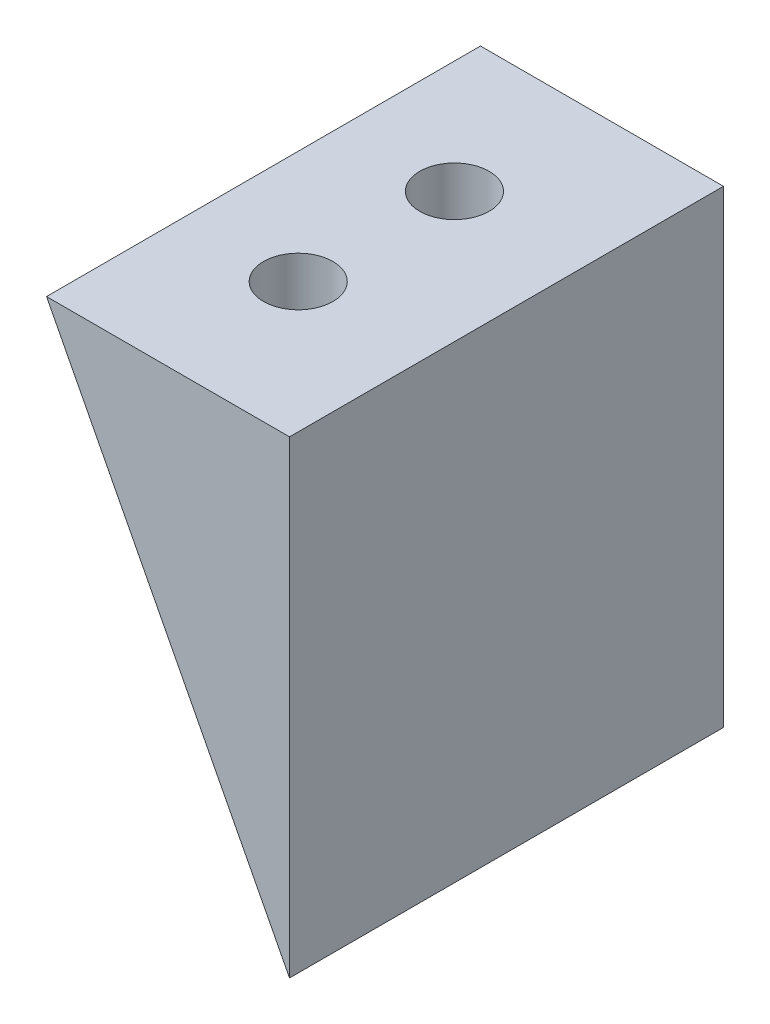
from build123d import *

# Parameters (mm, degrees)
BOSS_EXTRUDE1_DEPTH = 25
SKETCH2_R           = 2
CUT_EXTRUDE1_DEPTH  = 5


with BuildPart() as part:
    # Sketch1 → Boss-Extrude1 (new body)
    with BuildSketch(Plane.XY):
        Polygon((0, 0), (-14, 27), (0, 27), align=None)
    extrude(amount=BOSS_EXTRUDE1_DEPTH)

    # Sketch2 → Cut-Extrude1 (cut)
    with BuildSketch(Plane(origin=(0, 27, 0), x_dir=(1, 0, 0), z_dir=(0, 1, 0))):
        with Locations(Location((-7.5, -8, 0), (0, 0, 270))):
            Circle(SKETCH2_R)
        with Locations(Location((-7.5, -17, 0), (0, 0, 270))):
            Circle(SKETCH2_R)
    extrude(amount=-CUT_EXTRUDE1_DEPTH, mode=Mode.SUBTRACT)


solid = part.part
